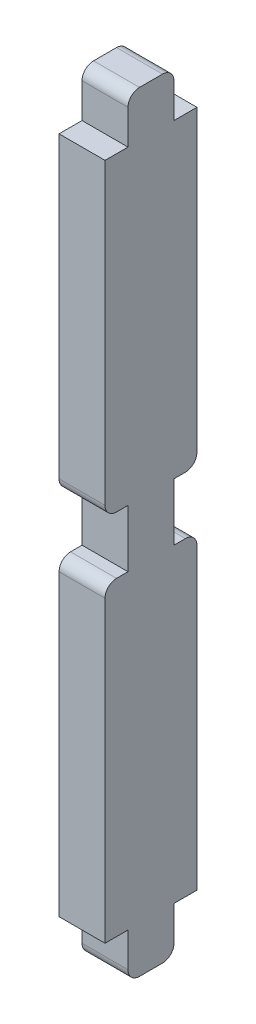
from build123d import *

# Parameters (mm, degrees)
BOSS_EXTRUDE1_DEPTH = 4
FILLET1_R           = 1
FILLET2_R           = 1


with BuildPart() as part:
    # Sketch1 → Boss-Extrude1 (new body)
    with BuildSketch(Plane.YZ):
        Polygon((-33.5, -2), (-33.5, 2), (-29.5, 2), (-29.5, 4), (-2.5, 4), (-2.5, 2), (2.5, 2), (2.5, 4), (29.5, 4), (29.5, 2), (33.5, 2), (33.5, -2), (29.5, -2), (29.5, -4), (2.5, -4), (2.5, -2), (-2.5, -2), (-2.5, -4), (-29.5, -4), (-29.5, -2), align=None)
    extrude(amount=BOSS_EXTRUDE1_DEPTH)

    # Fillet1
    fillet1_edges = [part.edges().sort_by_distance(p)[0] for p in [
        (2, -2.5, 4),
        (2, 2.5, 4),
        (2, 2.5, -4),
        (2, -2.5, -4),
    ]]
    fillet(fillet1_edges, radius=FILLET1_R)

    # Fillet2
    fillet2_edges = [part.edges().sort_by_distance(p)[0] for p in [
        (2, -33.5, -2),
        (2, -33.5, 2),
        (2, 33.5, 2),
        (2, 33.5, -2),
    ]]
    fillet(fillet2_edges, radius=FILLET2_R)


solid = part.part
